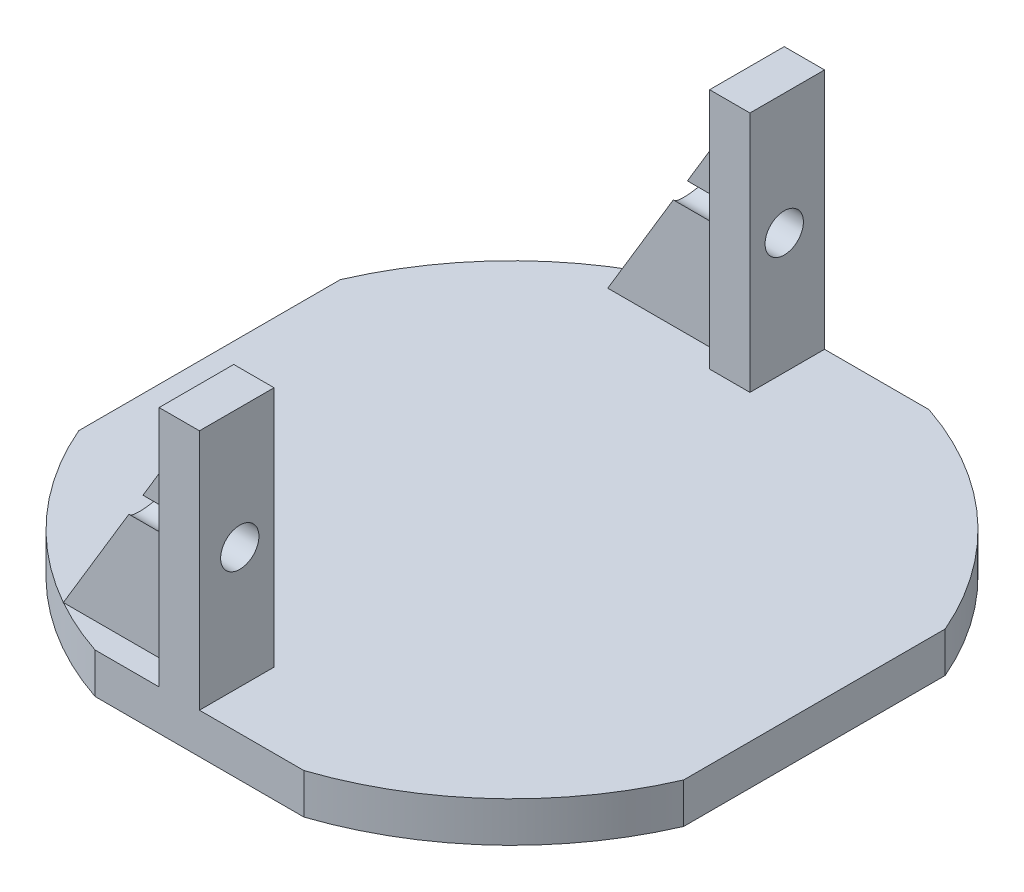
from build123d import *

# Parameters (mm, degrees)
SKETCH_1_R               = 6
SKETCH_1_R_2             = 4
EXTRUDE_1_DEPTH          = 5
CUT_EXTRUDE_1_REACH      = 16.318
CUT_EXTRUDE_1_END_RADIUS = 4
SKETCH_2_R               = 1.45
SKETCH_3_W               = 30
SKETCH_3_H               = 31
SKETCH_3_R               = 6
EXTRUDE_1_2_DEPTH        = 2
SKETCH_6_W               = 2
SKETCH_6_H               = 4
EXTRUDE_2_DEPTH          = 12
EXTRUDE_3_DEPTH          = 1.5
EXTRUDE_START            = -1.25
EXTRUDE_4_DEPTH          = 1.5
CUT_EXTRUDE_3_REACH      = 30.745
SKETCH_11_R              = 0.95
CUT_EXTRUDE_4_REACH      = 30.745
SKETCH_12_R              = 0.95
CUT_EXTRUDE_5_REACH      = 26.683
SKETCH_14_W              = 2
SKETCH_14_H              = 12
CUT_EXTRUDE_6_DEPTH      = 0.3
SKETCH_15_W              = 2
SKETCH_15_H              = 12
CUT_EXTRUDE_7_DEPTH      = 0.3


with BuildPart() as part:
    # 草图1 → Extrude 1 (new body)
    with BuildSketch(Plane(origin=(0, 0, 0), x_dir=(1, 0, 0), z_dir=(0, 1, 0))):
        Circle(SKETCH_1_R)
        Circle(SKETCH_1_R_2, mode=Mode.SUBTRACT)
    extrude(amount=EXTRUDE_1_DEPTH)

    # 切除-拉伸1: up to this cylinder (the profile starts outside it)
    cut_extrude_1_end = Plane(origin=(0, 2.637062, 0), z_dir=(0, -1, 0)) * Cylinder(CUT_EXTRUDE_1_END_RADIUS, 41.636, mode=Mode.PRIVATE)
    # 草图2 → 切除-拉伸1 (cut, up to the surface)
    with BuildSketch(Plane(origin=(6, 0, 0), x_dir=(0, 0, -1), z_dir=(1, 0, 0)), mode=Mode.PRIVATE) as cut_extrude_1_sk1:
        with Locations((0, 2.637062232)):
            Circle(SKETCH_2_R)
    cut_extrude_1_tool1 = extrude(cut_extrude_1_sk1.sketch, amount=-CUT_EXTRUDE_1_REACH, mode=Mode.PRIVATE) - cut_extrude_1_end
    add(cut_extrude_1_tool1.solids().sort_by_distance((6, 2.637062, 0))[0], mode=Mode.SUBTRACT)

    # 草图3 → Extrude 1 2 (add)
    # profile 1 of 2: a face of its own
    with BuildSketch(Plane(origin=(0, 5, 0), x_dir=(1, 0, 0), z_dir=(0, 1, 0))):
        Rectangle(SKETCH_3_W, SKETCH_3_H)
        Circle(SKETCH_3_R, mode=Mode.SUBTRACT)
    # profile 2 of 2: a face of its own
    with BuildSketch(Plane(origin=(0, 5, 0), x_dir=(1, 0, 0), z_dir=(0, 1, 0))):
        Circle(SKETCH_3_R)
    extrude(amount=EXTRUDE_1_2_DEPTH)

    # 草图6 → 凸台-拉伸2 (add)
    with BuildSketch(Plane(origin=(0, 7, 0), x_dir=(1, 0, 0), z_dir=(0, 1, 0))):
        with Locations((-1, 13.5)):
            Rectangle(SKETCH_6_W, SKETCH_6_H)
        with Locations((-1, -13.5)):
            Rectangle(SKETCH_6_W, SKETCH_6_H)
    extrude(amount=EXTRUDE_2_DEPTH)

    # 草图9 → 凸台-拉伸3 (add)
    with BuildSketch(Plane.XY.offset(-12.75)):
        Polygon((-2, 7), (-8, 7), (-2, 17), align=None)
    extrude(amount=-EXTRUDE_3_DEPTH)

    # 草图10 → 凸台-拉伸4 (add)
    with BuildSketch(Plane.XY.offset(15.5).offset(EXTRUDE_START)):
        Polygon((-2, 7), (-2, 17), (-8, 7), align=None)
    extrude(amount=-EXTRUDE_4_DEPTH)

    # 草图11 → 切除-拉伸3 (cut, up to next)
    with BuildSketch(Plane(origin=(0, 0, 0), x_dir=(0, 0, -1), z_dir=(1, 0, 0)), mode=Mode.PRIVATE) as cut_extrude_3_sk1:
        with Locations((-13.5, 13)):
            Circle(SKETCH_11_R)
    cut_extrude_3_tool1 = extrude(cut_extrude_3_sk1.sketch, amount=-CUT_EXTRUDE_3_REACH, mode=Mode.PRIVATE) & part.part
    add(cut_extrude_3_tool1.solids().sort_by_distance((0, 13, 13.5))[0], mode=Mode.SUBTRACT)

    # 草图12 → 切除-拉伸4 (cut, up to next)
    with BuildSketch(Plane(origin=(0, 0, 0), x_dir=(0, 0, -1), z_dir=(1, 0, 0)), mode=Mode.PRIVATE) as cut_extrude_4_sk1:
        with Locations((13.5, 13)):
            Circle(SKETCH_12_R)
    cut_extrude_4_tool1 = extrude(cut_extrude_4_sk1.sketch, amount=-CUT_EXTRUDE_4_REACH, mode=Mode.PRIVATE) & part.part
    add(cut_extrude_4_tool1.solids().sort_by_distance((0, 13, -13.5))[0], mode=Mode.SUBTRACT)

    # 草图13 → 切除-拉伸5 (cut, up to next)
    with BuildSketch(Plane(origin=(0, 7, 0), x_dir=(1, 0, 0), z_dir=(0, 1, 0)), mode=Mode.PRIVATE) as cut_extrude_5_sk1:
        with BuildLine():
            ThreePointArc((-5.178078794, -15.5), (-6.61861505, -14.941768129), (-8, -14.25))
            ThreePointArc((-8, -14.25), (-12.137612149, -10.942617206), (-15, -6.485560886))
            Line((-15, -6.485560886), (-15, -15.5))
            Line((-15, -15.5), (-5.178078794, -15.5))
        make_face()
    cut_extrude_5_tool1 = extrude(cut_extrude_5_sk1.sketch, amount=-CUT_EXTRUDE_5_REACH, mode=Mode.PRIVATE) & part.part
    # 草图13 → 切除-拉伸5 (cut, up to next)
    with BuildSketch(Plane(origin=(0, 7, 0), x_dir=(1, 0, 0), z_dir=(0, 1, 0)), mode=Mode.PRIVATE) as cut_extrude_5_sk2:
        with BuildLine():
            ThreePointArc((15, -6.485560886), (11.050056294, -12.039881889), (5.178078794, -15.5))
            Line((5.178078794, -15.5), (15, -15.5))
            Line((15, -15.5), (15, -6.485560886))
        make_face()
    cut_extrude_5_tool2 = extrude(cut_extrude_5_sk2.sketch, amount=-CUT_EXTRUDE_5_REACH, mode=Mode.PRIVATE) & part.part
    # 草图13 → 切除-拉伸5 (cut, up to next)
    with BuildSketch(Plane(origin=(0, 7, 0), x_dir=(1, 0, 0), z_dir=(0, 1, 0)), mode=Mode.PRIVATE) as cut_extrude_5_sk3:
        with BuildLine():
            ThreePointArc((5.178078794, 15.5), (11.050056294, 12.039881889), (15, 6.485560886))
            Line((15, 6.485560886), (15, 15.5))
            Line((15, 15.5), (5.178078794, 15.5))
        make_face()
    cut_extrude_5_tool3 = extrude(cut_extrude_5_sk3.sketch, amount=-CUT_EXTRUDE_5_REACH, mode=Mode.PRIVATE) & part.part
    # 草图13 → 切除-拉伸5 (cut, up to next)
    with BuildSketch(Plane(origin=(0, 7, 0), x_dir=(1, 0, 0), z_dir=(0, 1, 0)), mode=Mode.PRIVATE) as cut_extrude_5_sk4:
        with BuildLine():
            Line((-15, 15.5), (-15, 6.485560886))
            ThreePointArc((-15, 6.485560886), (-12.137612149, 10.942617206), (-8, 14.25))
            ThreePointArc((-8, 14.25), (-6.61861505, 14.941768129), (-5.178078794, 15.5))
            Line((-5.178078794, 15.5), (-15, 15.5))
        make_face()
    cut_extrude_5_tool4 = extrude(cut_extrude_5_sk4.sketch, amount=-CUT_EXTRUDE_5_REACH, mode=Mode.PRIVATE) & part.part
    add(cut_extrude_5_tool1.solids().sort_by_distance((-12.231882, 7, 12.932652))[0], mode=Mode.SUBTRACT)
    add(cut_extrude_5_tool2.solids().sort_by_distance((12.231882, 7, 12.932652))[0], mode=Mode.SUBTRACT)
    add(cut_extrude_5_tool3.solids().sort_by_distance((12.231882, 7, -12.932652))[0], mode=Mode.SUBTRACT)
    add(cut_extrude_5_tool4.solids().sort_by_distance((-12.231882, 7, -12.932652))[0], mode=Mode.SUBTRACT)

    # 草图14 → 切除-拉伸6 (cut)
    with BuildSketch(Plane(origin=(0, 0, 11.5), x_dir=(-1, 0, 0), z_dir=(0, 0, -1))):
        with Locations((1, 13)):
            Rectangle(SKETCH_14_W, SKETCH_14_H)
    extrude(amount=-CUT_EXTRUDE_6_DEPTH, mode=Mode.SUBTRACT)

    # 草图15 → 切除-拉伸7 (cut)
    with BuildSketch(Plane.XY.offset(-11.5)):
        with Locations((-1, 13)):
            Rectangle(SKETCH_15_W, SKETCH_15_H)
    extrude(amount=-CUT_EXTRUDE_7_DEPTH, mode=Mode.SUBTRACT)


solid = part.part
